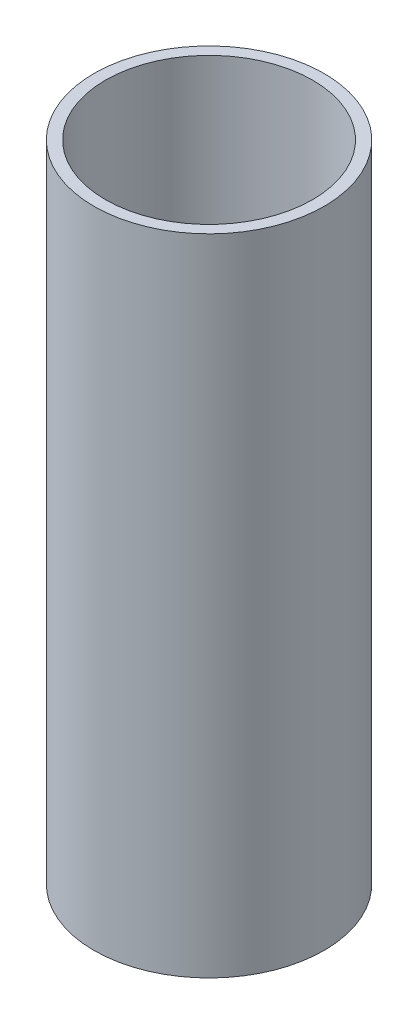
from build123d import *

# Parameters (mm, degrees)
BASES_R    = 5
BASES_R_2  = 4.5
BASE_DEPTH = 14


with BuildPart() as part:
    # BaseS → BASE (new, symmetric)
    with BuildSketch(Plane(origin=(0, 0, 0), x_dir=(1, 0, 0), z_dir=(0, 1, 0))):
        with Locations(Location((0, 0, 0), (0, 0, 270))):
            Circle(BASES_R)
        with Locations(Location((0, 0, 0), (0, 0, 270))):
            Circle(BASES_R_2, mode=Mode.SUBTRACT)
    extrude(amount=BASE_DEPTH, both=True)


solid = part.part
